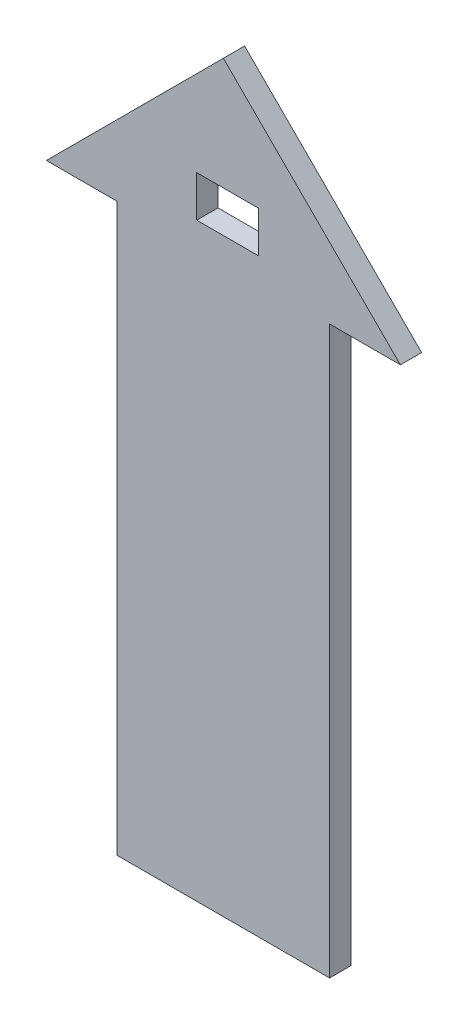
from build123d import *

# Parameters (mm, degrees)
BOSS_EXTRUDE2_DEPTH = 3
SKETCH2_W           = 8.689494808
SKETCH2_H           = 5.818516347
CUT_EXTRUDE1_DEPTH  = 3


with BuildPart() as part:
    # Model → Boss-Extrude2 (new body)
    with BuildSketch(Plane.XY):
        Polygon((0, 0), (30, 0), (30, 80), (40, 80), (15, 105), (-10, 80), (0, 80), align=None)
    extrude(amount=BOSS_EXTRUDE2_DEPTH)

    # Sketch2 → Cut-Extrude1 (cut)
    with BuildSketch(Plane.XY.offset(3)):
        with Locations((15.580557609, 86.224591519)):
            Rectangle(SKETCH2_W, SKETCH2_H)
    extrude(amount=-CUT_EXTRUDE1_DEPTH, mode=Mode.SUBTRACT)


solid = part.part
